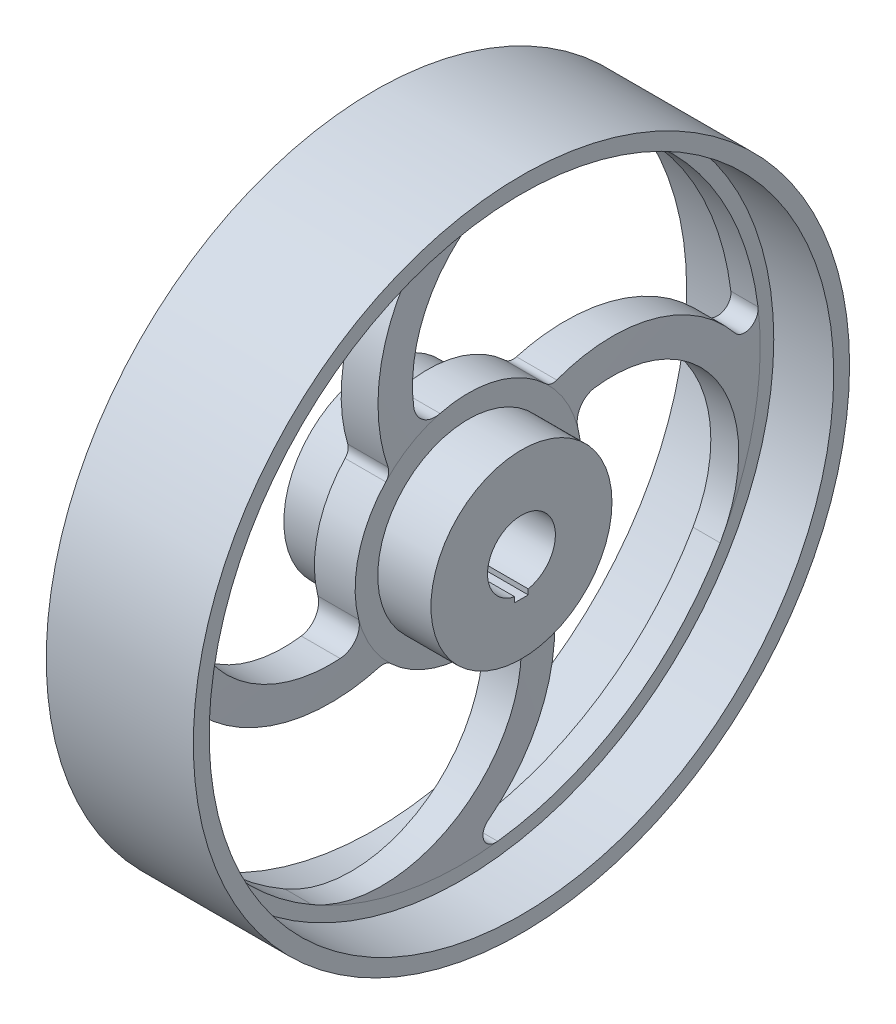
from build123d import *

# Parameters (mm, degrees)
SKETCH1_W          = 18
SKETCH1_H          = 10
SKETCH1_W_2        = 12
SKETCH1_H_2        = 6
CUT_EXTRUDE2_DEPTH = 25
SKETCH4_W          = 6
SKETCH4_H          = 4
CUT_EXTRUDE3_DEPTH = 80


with BuildPart() as part:
    # Sketch1 → Revolve2 (revolve)
    with BuildSketch(Plane.XY, mode=Mode.PRIVATE) as revolve2_sk:
        Polygon((-32.5, 40), (-32.5, 15), (32.5, 15), (32.5, 40), (9, 40), (9, 30), (-9, 30), (-9, 40), align=None)
        with Locations((0, 45)):
            Rectangle(SKETCH1_W, SKETCH1_H)
        Polygon((6, 132), (9, 50), (-9, 50), (-6, 132), align=None)
        with Locations((0, 35)):
            Rectangle(SKETCH1_W, SKETCH1_H)
        with Locations((0, 135)):
            Rectangle(SKETCH1_W_2, SKETCH1_H_2)
        with Locations((0, 141)):
            Rectangle(SKETCH1_W_2, SKETCH1_H_2)
        Polygon((-32.5, 138), (-6, 138), (-6, 144), (6, 144), (6, 138), (32.5, 138), (32.5, 145), (-32.5, 145), align=None)
    revolve(revolve2_sk.sketch.rotate(Axis((-32.5, 0, 0), (1, 0, 0)), 270), axis=Axis((-32.5, 0, 0), (1, 0, 0)))

    # Sketch3 → Cut-Extrude2 (cut, symmetric)
    with BuildSketch(Plane(origin=(0, 0, 0), x_dir=(0, 0, -1), z_dir=(1, 0, 0))):
        with BuildLine():
            ThreePointArc((-12.484646401, 48.416253513), (12.41086158, 48.435219777), (34.229534896, 36.446384468))
            ThreePointArc((34.229534896, 36.446384468), (36.560984376, 35.211615267), (39.196322178, 35.335333983))
            ThreePointArc((39.196322178, 35.335333983), (83.502723918, 35.956405183), (120.426965872, 11.460623492))
            ThreePointArc((120.426965872, 11.460623492), (127.427450909, 9.738805209), (131.028665236, 15.984019722))
            ThreePointArc((131.028665236, 15.984019722), (110.101482833, 72.812522811), (66, 114.3153533))
            ThreePointArc((66, 114.3153533), (3.375393912, 112.70891896), (-23.684567946, 56.20953504))
            ThreePointArc((-23.684567946, 56.20953504), (-19.872366221, 49.743660636), (-12.484646401, 48.416253513))
        make_face()
        with BuildLine():
            ThreePointArc((48.416253513, 12.484646401), (49.602483182, 6.292349496), (50, 0))
            ThreePointArc((50, 0), (46.488273916, -18.40761767), (36.446384468, -34.229534896))
            ThreePointArc((36.446384468, -34.229534896), (35.211615267, -36.560984376), (35.335333983, -39.196322178))
            ThreePointArc((35.335333983, -39.196322178), (35.956405183, -83.502723918), (11.460623492, -120.426965872))
            ThreePointArc((11.460623492, -120.426965872), (9.738805209, -127.427450909), (15.984019722, -131.028665236))
            ThreePointArc((15.984019722, -131.028665236), (72.812522811, -110.101482833), (114.3153533, -66))
            ThreePointArc((114.3153533, -66), (112.70891896, -3.375393912), (56.20953504, 23.684567946))
            ThreePointArc((56.20953504, 23.684567946), (49.743660636, 19.872366221), (48.416253513, 12.484646401))
        make_face()
        with BuildLine():
            ThreePointArc((23.684567946, -56.20953504), (19.872366221, -49.743660636), (12.484646401, -48.416253513))
            ThreePointArc((12.484646401, -48.416253513), (-12.41086158, -48.435219777), (-34.229534896, -36.446384468))
            ThreePointArc((-34.229534896, -36.446384468), (-36.560984376, -35.211615267), (-39.196322178, -35.335333983))
            ThreePointArc((-39.196322178, -35.335333983), (-83.502723918, -35.956405183), (-120.426965872, -11.460623492))
            ThreePointArc((-120.426965872, -11.460623492), (-127.427450909, -9.738805209), (-131.028665236, -15.984019722))
            ThreePointArc((-131.028665236, -15.984019722), (-110.101482833, -72.812522811), (-66, -114.3153533))
            ThreePointArc((-66, -114.3153533), (-3.375393912, -112.70891896), (23.684567946, -56.20953504))
        make_face()
        with BuildLine():
            ThreePointArc((-48.416253513, -12.484646401), (-48.435219777, 12.41086158), (-36.446384468, 34.229534896))
            ThreePointArc((-36.446384468, 34.229534896), (-35.211615267, 36.560984376), (-35.335333983, 39.196322178))
            ThreePointArc((-35.335333983, 39.196322178), (-35.956405183, 83.502723918), (-11.460623492, 120.426965872))
            ThreePointArc((-11.460623492, 120.426965872), (-9.738805209, 127.427450909), (-15.984019722, 131.028665236))
            ThreePointArc((-15.984019722, 131.028665236), (-72.812522811, 110.101482833), (-114.3153533, 66))
            ThreePointArc((-114.3153533, 66), (-112.70891896, 3.375393912), (-56.20953504, -23.684567946))
            ThreePointArc((-56.20953504, -23.684567946), (-49.743660636, -19.872366221), (-48.416253513, -12.484646401))
        make_face()
    extrude(amount=CUT_EXTRUDE2_DEPTH, both=True, mode=Mode.SUBTRACT)

    # Sketch4 → Cut-Extrude3 (cut)
    with BuildSketch(Plane(origin=(32.5, 0, 0), x_dir=(0, 0, -1), z_dir=(1, 0, 0))):
        with Locations((0, -15)):
            Rectangle(SKETCH4_W, SKETCH4_H)
    extrude(amount=-CUT_EXTRUDE3_DEPTH, mode=Mode.SUBTRACT)


solid = part.part
